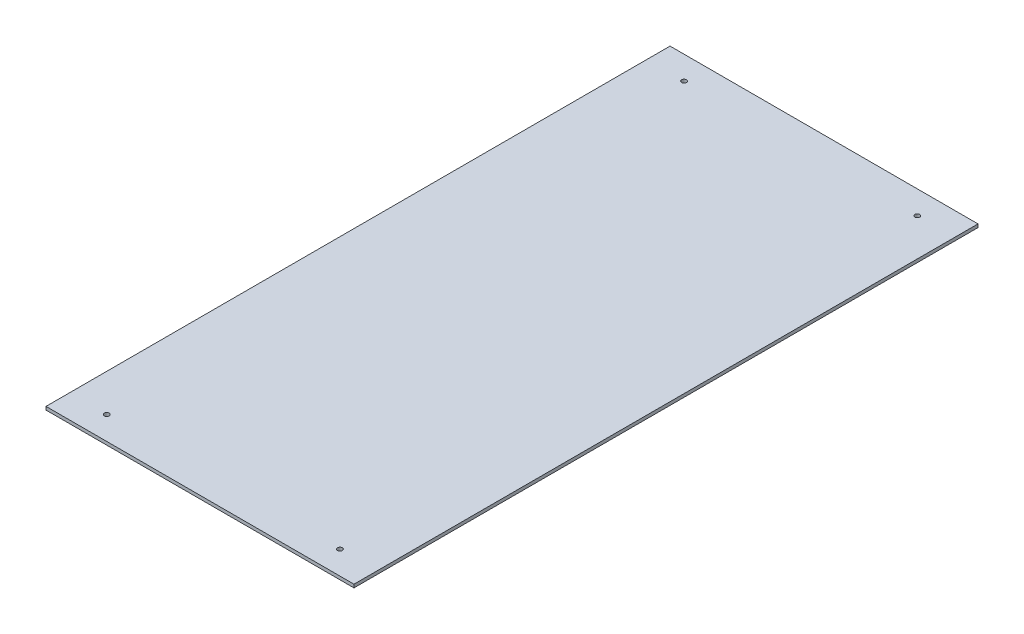
from build123d import *

# Parameters (mm, degrees)
SKETCH1_W           = 190
SKETCH1_H           = 385
SKETCH1_R           = 1.5
BOSS_EXTRUDE1_DEPTH = 2


with BuildPart() as part:
    # Sketch1 → Boss-Extrude1 (new body)
    with BuildSketch(Plane(origin=(0, 0, 0), x_dir=(1, 0, 0), z_dir=(0, 1, 0))):
        Rectangle(SKETCH1_W, SKETCH1_H)
        with Locations(Location((-71.93, 178.11, 0), (0, 0, 270))):
            Circle(SKETCH1_R, mode=Mode.SUBTRACT)
        with Locations(Location((71.93, 178.11, 0), (0, 0, 90))):
            Circle(SKETCH1_R, mode=Mode.SUBTRACT)
        with Locations(Location((71.93, -178.11, 0), (0, 0, 270))):
            Circle(SKETCH1_R, mode=Mode.SUBTRACT)
        with Locations(Location((-71.93, -178.11, 0), (0, 0, 90))):
            Circle(SKETCH1_R, mode=Mode.SUBTRACT)
    extrude(amount=BOSS_EXTRUDE1_DEPTH)


solid = part.part
